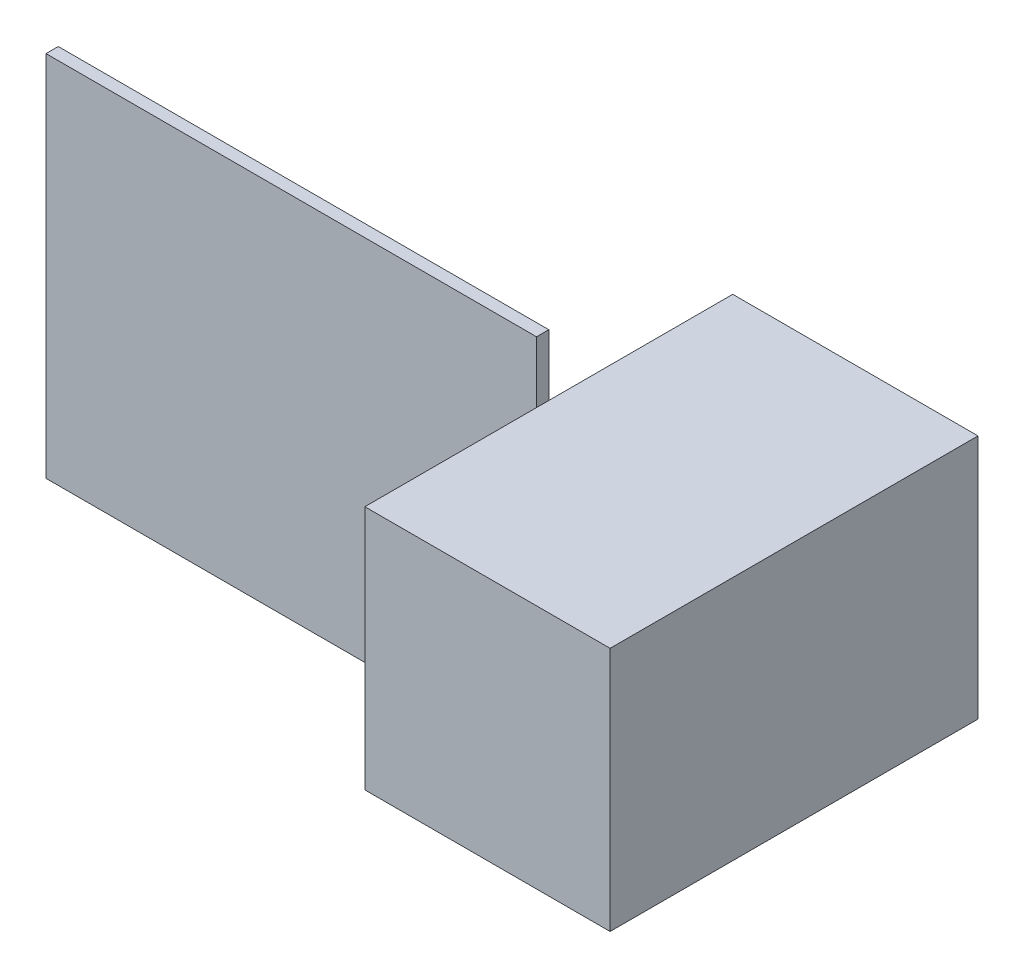
from build123d import *

# Parameters (mm, degrees)
SKETCH_2_W      = 80
SKETCH_2_H      = 60
EXTRUDE_1_DEPTH = 2
SKETCH_3_W      = 60
SKETCH_3_H      = 40
EXTRUDE_2_DEPTH = 40


with BuildPart() as part:
    # 草图2 → 凸台-拉伸1 (new body)
    with BuildSketch(Plane.XY):
        Rectangle(SKETCH_2_W, SKETCH_2_H)
    extrude(amount=EXTRUDE_1_DEPTH)

    # 草图3 → 凸台-拉伸2 (add)
    with BuildSketch(Plane(origin=(40, 0, 0), x_dir=(0, 0, -1), z_dir=(1, 0, 0))):
        Rectangle(SKETCH_3_W, SKETCH_3_H)
    extrude(amount=EXTRUDE_2_DEPTH)


solid = part.part
